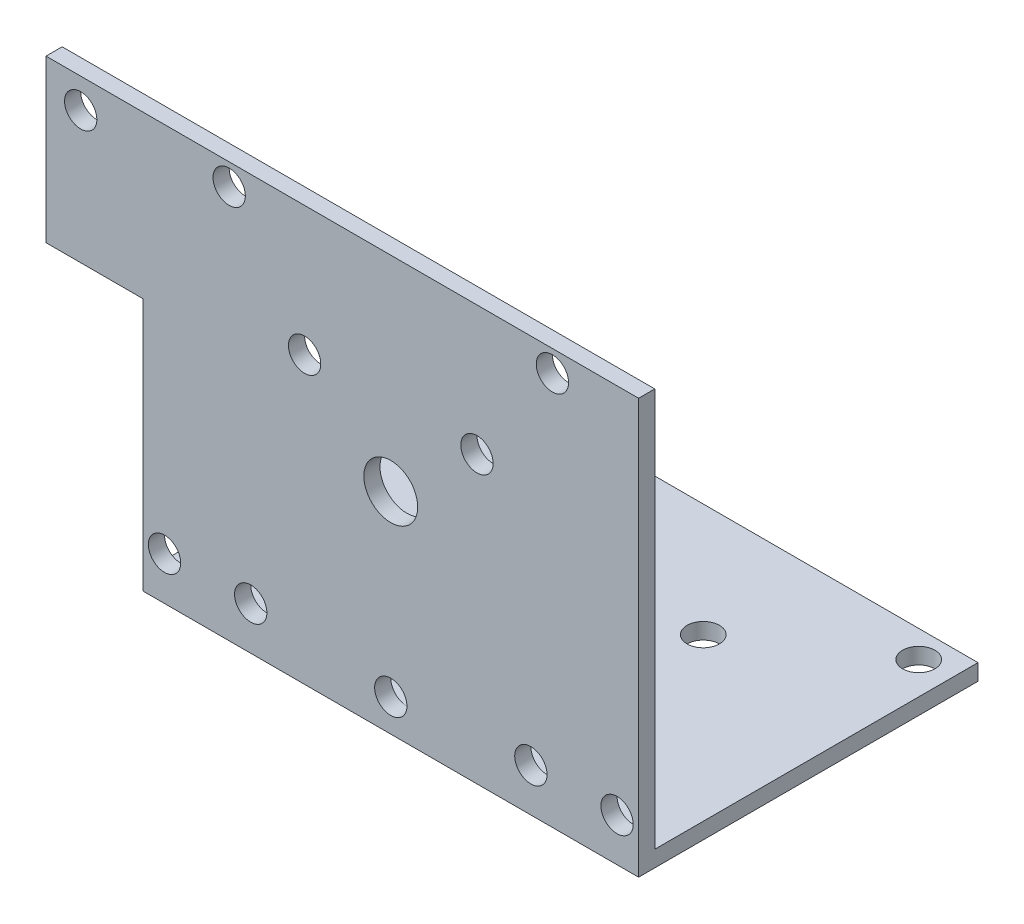
from build123d import *

# Parameters (mm, degrees)
SKETCH_1_W          = 46
SKETCH_1_H          = 38.5
EXTRUDE_1_DEPTH     = 1.5
SKETCH_2_W          = 46
SKETCH_2_H          = 1.5
EXTRUDE_2_DEPTH     = 30
CUT_EXTRUDE_1_REACH = 54.896
SKETCH_3_R          = 1.5
CUT_EXTRUDE_2_REACH = 45.495
SKETCH_4_R          = 1.5
SKETCH_4_R_2        = 2.5
SKETCH_5_W          = 9
SKETCH_5_H          = 15
SKETCH_5_R          = 1.5
EXTRUDE_3_DEPTH     = 1.5


with BuildPart() as part:
    # Эскиз1 → Бобышка-Вытянуть1 (new body)
    with BuildSketch(Plane.XY):
        Rectangle(SKETCH_1_W, SKETCH_1_H)
    extrude(amount=EXTRUDE_1_DEPTH)

    # Эскиз2 → Бобышка-Вытянуть2 (add)
    with BuildSketch(Plane(origin=(0, 0, 0), x_dir=(-1, 0, 0), z_dir=(0, 0, -1))):
        with Locations((0, -18.5)):
            Rectangle(SKETCH_2_W, SKETCH_2_H)
    extrude(amount=EXTRUDE_2_DEPTH)

    # Эскиз3 → Вырез-Вытянуть1 (cut, up to next)
    with BuildSketch(Plane(origin=(0, -17.75, 0), x_dir=(1, 0, 0), z_dir=(0, 1, 0)), mode=Mode.PRIVATE) as cut_extrude_1_sk1:
        with Locations(Location((-8, 19.5, 0), (0, 0, 180))):
            Circle(SKETCH_3_R)
    cut_extrude_1_tool1 = extrude(cut_extrude_1_sk1.sketch, amount=-CUT_EXTRUDE_1_REACH, mode=Mode.PRIVATE) & part.part
    # Эскиз3 → Вырез-Вытянуть1 (cut, up to next)
    with BuildSketch(Plane(origin=(0, -17.75, 0), x_dir=(1, 0, 0), z_dir=(0, 1, 0)), mode=Mode.PRIVATE) as cut_extrude_1_sk2:
        with Locations(Location((8, 19.5, 0), (0, 0, 180))):
            Circle(SKETCH_3_R)
    cut_extrude_1_tool2 = extrude(cut_extrude_1_sk2.sketch, amount=-CUT_EXTRUDE_1_REACH, mode=Mode.PRIVATE) & part.part
    # Эскиз3 → Вырез-Вытянуть1 (cut, up to next)
    with BuildSketch(Plane(origin=(0, -17.75, 0), x_dir=(1, 0, 0), z_dir=(0, 1, 0)), mode=Mode.PRIVATE) as cut_extrude_1_sk3:
        with Locations(Location((-8, 4.5, 0), (0, 0, 180))):
            Circle(SKETCH_3_R)
    cut_extrude_1_tool3 = extrude(cut_extrude_1_sk3.sketch, amount=-CUT_EXTRUDE_1_REACH, mode=Mode.PRIVATE) & part.part
    # Эскиз3 → Вырез-Вытянуть1 (cut, up to next)
    with BuildSketch(Plane(origin=(0, -17.75, 0), x_dir=(1, 0, 0), z_dir=(0, 1, 0)), mode=Mode.PRIVATE) as cut_extrude_1_sk4:
        with Locations(Location((8, 4.5, 0), (0, 0, 180))):
            Circle(SKETCH_3_R)
    cut_extrude_1_tool4 = extrude(cut_extrude_1_sk4.sketch, amount=-CUT_EXTRUDE_1_REACH, mode=Mode.PRIVATE) & part.part
    # Эскиз3 → Вырез-Вытянуть1 (cut, up to next)
    with BuildSketch(Plane(origin=(0, -17.75, 0), x_dir=(1, 0, 0), z_dir=(0, 1, 0)), mode=Mode.PRIVATE) as cut_extrude_1_sk5:
        with Locations(Location((-20, 27.5, 0), (0, 0, 180))):
            Circle(SKETCH_3_R)
    cut_extrude_1_tool5 = extrude(cut_extrude_1_sk5.sketch, amount=-CUT_EXTRUDE_1_REACH, mode=Mode.PRIVATE) & part.part
    # Эскиз3 → Вырез-Вытянуть1 (cut, up to next)
    with BuildSketch(Plane(origin=(0, -17.75, 0), x_dir=(1, 0, 0), z_dir=(0, 1, 0)), mode=Mode.PRIVATE) as cut_extrude_1_sk6:
        with Locations(Location((20, 27.5, 0), (0, 0, 180))):
            Circle(SKETCH_3_R)
    cut_extrude_1_tool6 = extrude(cut_extrude_1_sk6.sketch, amount=-CUT_EXTRUDE_1_REACH, mode=Mode.PRIVATE) & part.part
    add(cut_extrude_1_tool1.solids().sort_by_distance((-8, -17.75, -19.5))[0], mode=Mode.SUBTRACT)
    add(cut_extrude_1_tool2.solids().sort_by_distance((8, -17.75, -19.5))[0], mode=Mode.SUBTRACT)
    add(cut_extrude_1_tool3.solids().sort_by_distance((-8, -17.75, -4.5))[0], mode=Mode.SUBTRACT)
    add(cut_extrude_1_tool4.solids().sort_by_distance((8, -17.75, -4.5))[0], mode=Mode.SUBTRACT)
    add(cut_extrude_1_tool5.solids().sort_by_distance((-20, -17.75, -27.5))[0], mode=Mode.SUBTRACT)
    add(cut_extrude_1_tool6.solids().sort_by_distance((20, -17.75, -27.5))[0], mode=Mode.SUBTRACT)

    # Эскиз4 → Вырез-Вытянуть2 (cut, up to next)
    with BuildSketch(Plane.XY.offset(1.5), mode=Mode.PRIVATE) as cut_extrude_2_sk1:
        with Locations((-15, 17.25)):
            Circle(SKETCH_4_R)
    cut_extrude_2_tool1 = extrude(cut_extrude_2_sk1.sketch, amount=-CUT_EXTRUDE_2_REACH, mode=Mode.PRIVATE) & part.part
    # Эскиз4 → Вырез-Вытянуть2 (cut, up to next)
    with BuildSketch(Plane.XY.offset(1.5), mode=Mode.PRIVATE) as cut_extrude_2_sk2:
        with Locations((15, 17.25)):
            Circle(SKETCH_4_R)
    cut_extrude_2_tool2 = extrude(cut_extrude_2_sk2.sketch, amount=-CUT_EXTRUDE_2_REACH, mode=Mode.PRIVATE) & part.part
    # Эскиз4 → Вырез-Вытянуть2 (cut, up to next)
    with BuildSketch(Plane.XY.offset(1.5), mode=Mode.PRIVATE) as cut_extrude_2_sk3:
        with Locations((-8, 7.25)):
            Circle(SKETCH_4_R)
    cut_extrude_2_tool3 = extrude(cut_extrude_2_sk3.sketch, amount=-CUT_EXTRUDE_2_REACH, mode=Mode.PRIVATE) & part.part
    # Эскиз4 → Вырез-Вытянуть2 (cut, up to next)
    with BuildSketch(Plane.XY.offset(1.5), mode=Mode.PRIVATE) as cut_extrude_2_sk4:
        with Locations(Location((8, 7.25, 0), (0, 0, 180))):
            Circle(SKETCH_4_R)
    cut_extrude_2_tool4 = extrude(cut_extrude_2_sk4.sketch, amount=-CUT_EXTRUDE_2_REACH, mode=Mode.PRIVATE) & part.part
    # Эскиз4 → Вырез-Вытянуть2 (cut, up to next)
    with BuildSketch(Plane.XY.offset(1.5), mode=Mode.PRIVATE) as cut_extrude_2_sk5:
        with Locations((0, 0.25)):
            Circle(SKETCH_4_R_2)
    cut_extrude_2_tool5 = extrude(cut_extrude_2_sk5.sketch, amount=-CUT_EXTRUDE_2_REACH, mode=Mode.PRIVATE) & part.part
    # Эскиз4 → Вырез-Вытянуть2 (cut, up to next)
    with BuildSketch(Plane.XY.offset(1.5), mode=Mode.PRIVATE) as cut_extrude_2_sk6:
        with Locations((0, -16.25)):
            Circle(SKETCH_4_R)
    cut_extrude_2_tool6 = extrude(cut_extrude_2_sk6.sketch, amount=-CUT_EXTRUDE_2_REACH, mode=Mode.PRIVATE) & part.part
    # Эскиз4 → Вырез-Вытянуть2 (cut, up to next)
    with BuildSketch(Plane.XY.offset(1.5), mode=Mode.PRIVATE) as cut_extrude_2_sk7:
        with Locations((-21, -15.25)):
            Circle(SKETCH_4_R)
    cut_extrude_2_tool7 = extrude(cut_extrude_2_sk7.sketch, amount=-CUT_EXTRUDE_2_REACH, mode=Mode.PRIVATE) & part.part
    # Эскиз4 → Вырез-Вытянуть2 (cut, up to next)
    with BuildSketch(Plane.XY.offset(1.5), mode=Mode.PRIVATE) as cut_extrude_2_sk8:
        with Locations(Location((21, -15.25, 0), (0, 0, 180))):
            Circle(SKETCH_4_R)
    cut_extrude_2_tool8 = extrude(cut_extrude_2_sk8.sketch, amount=-CUT_EXTRUDE_2_REACH, mode=Mode.PRIVATE) & part.part
    # Эскиз4 → Вырез-Вытянуть2 (cut, up to next)
    with BuildSketch(Plane.XY.offset(1.5), mode=Mode.PRIVATE) as cut_extrude_2_sk9:
        with Locations((-13, -15.25)):
            Circle(SKETCH_4_R)
    cut_extrude_2_tool9 = extrude(cut_extrude_2_sk9.sketch, amount=-CUT_EXTRUDE_2_REACH, mode=Mode.PRIVATE) & part.part
    # Эскиз4 → Вырез-Вытянуть2 (cut, up to next)
    with BuildSketch(Plane.XY.offset(1.5), mode=Mode.PRIVATE) as cut_extrude_2_sk10:
        with Locations(Location((13, -15.25, 0), (0, 0, 180))):
            Circle(SKETCH_4_R)
    cut_extrude_2_tool10 = extrude(cut_extrude_2_sk10.sketch, amount=-CUT_EXTRUDE_2_REACH, mode=Mode.PRIVATE) & part.part
    add(cut_extrude_2_tool1.solids().sort_by_distance((-15, 17.25, 1.5))[0], mode=Mode.SUBTRACT)
    add(cut_extrude_2_tool2.solids().sort_by_distance((15, 17.25, 1.5))[0], mode=Mode.SUBTRACT)
    add(cut_extrude_2_tool3.solids().sort_by_distance((-8, 7.25, 1.5))[0], mode=Mode.SUBTRACT)
    add(cut_extrude_2_tool4.solids().sort_by_distance((8, 7.25, 1.5))[0], mode=Mode.SUBTRACT)
    add(cut_extrude_2_tool5.solids().sort_by_distance((0, 0.25, 1.5))[0], mode=Mode.SUBTRACT)
    add(cut_extrude_2_tool6.solids().sort_by_distance((0, -16.25, 1.5))[0], mode=Mode.SUBTRACT)
    add(cut_extrude_2_tool7.solids().sort_by_distance((-21, -15.25, 1.5))[0], mode=Mode.SUBTRACT)
    add(cut_extrude_2_tool8.solids().sort_by_distance((21, -15.25, 1.5))[0], mode=Mode.SUBTRACT)
    add(cut_extrude_2_tool9.solids().sort_by_distance((-13, -15.25, 1.5))[0], mode=Mode.SUBTRACT)
    add(cut_extrude_2_tool10.solids().sort_by_distance((13, -15.25, 1.5))[0], mode=Mode.SUBTRACT)

    # Эскиз5 → Бобышка-Вытянуть3 (add)
    with BuildSketch(Plane(origin=(0, 0, 0), x_dir=(-1, 0, 0), z_dir=(0, 0, -1))):
        with Locations((27.5, 11.75)):
            Rectangle(SKETCH_5_W, SKETCH_5_H)
        with Locations((28.78, 16.5)):
            Circle(SKETCH_5_R, mode=Mode.SUBTRACT)
    extrude(amount=-EXTRUDE_3_DEPTH)


solid = part.part
